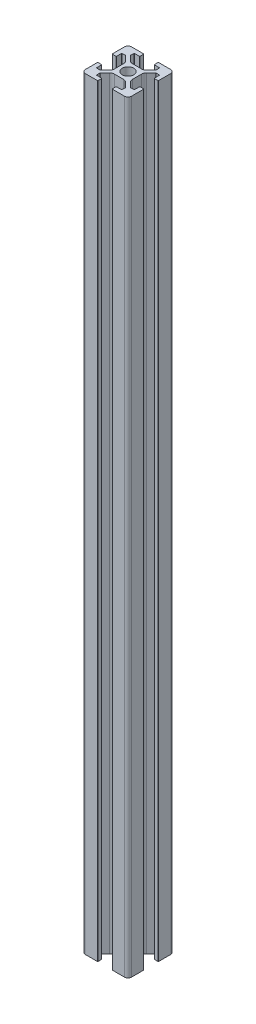
from build123d import *
from build123d.topology import SkipClean

# Parameters (mm, degrees)
BOSS_EXTRUDE1_DEPTH = 330
FILLET1_R           = 1.5
FILLET2_R           = 0.2
FILLET3_R           = 2
SKETCH2_R           = 2.1
CUT_EXTRUDE1_DEPTH  = 332.209903234


with BuildPart() as part:
    # Sketch1 → Boss-Extrude1 (new body)
    with BuildSketch(Plane(origin=(0, 0, 0), x_dir=(1, 0, 0), z_dir=(0, 1, 0))):
        Polygon((0, 20), (0, 13.1), (1.8, 13.1), (1.8, 15.5), (1.8, 17.139339828), (1.8, 18.2), (2.860660172, 18.2), (4.5, 18.2), (6.9, 18.2), (6.9, 20), align=None)
        Polygon((1.8, 18.2), (1.8, 17.139339828), (3.439339828, 15.5), (4.5, 15.5), (4.5, 16.560660172), (2.860660172, 18.2), align=None)
        Polygon((4.5, 16.560660172), (4.5, 18.2), (2.860660172, 18.2), align=None)
        Polygon((1.8, 17.139339828), (1.8, 15.5), (3.439339828, 15.5), align=None)
        Polygon((4.5, 15.5), (3.439339828, 15.5), (6.1, 12.839339828), (6.1, 13.9), (7.160660172, 13.9), (4.5, 16.560660172), align=None)
        Polygon((18.2, 13.1), (20, 13.1), (20, 20), (13.1, 20), (13.1, 18.2), (15.5, 18.2), (17.139339828, 18.2), (18.2, 18.2), (18.2, 17.139339828), (18.2, 15.5), align=None)
        Polygon((17.139339828, 18.2), (15.5, 18.2), (15.5, 16.560660172), align=None)
        Polygon((16.560660172, 15.5), (18.2, 17.139339828), (18.2, 18.2), (17.139339828, 18.2), (15.5, 16.560660172), (15.5, 15.5), align=None)
        Polygon((16.560660172, 15.5), (18.2, 15.5), (18.2, 17.139339828), align=None)
        Polygon((13.9, 12.839339828), (16.560660172, 15.5), (15.5, 15.5), (15.5, 16.560660172), (12.839339828, 13.9), (13.9, 13.9), align=None)
        with BuildLine():
            Line((12.839339828, 13.9), (7.160660172, 13.9))
            Line((7.160660172, 13.9), (8.84398789, 12.216672281))
            ThreePointArc((8.84398789, 12.216672281), (10, 12.5), (11.15601211, 12.216672281))
            Line((11.15601211, 12.216672281), (12.839339828, 13.9))
        make_face()
        with BuildLine():
            Line((6.1, 13.9), (6.1, 12.839339828))
            Line((6.1, 12.839339828), (7.783327719, 11.15601211))
            ThreePointArc((7.783327719, 11.15601211), (8.232233047, 11.767766953), (8.84398789, 12.216672281))
            Line((8.84398789, 12.216672281), (7.160660172, 13.9))
            Line((7.160660172, 13.9), (6.1, 13.9))
        make_face()
        with BuildLine():
            Line((12.216672281, 11.15601211), (13.9, 12.839339828))
            Line((13.9, 12.839339828), (13.9, 13.9))
            Line((13.9, 13.9), (12.839339828, 13.9))
            Line((12.839339828, 13.9), (11.15601211, 12.216672281))
            ThreePointArc((11.15601211, 12.216672281), (11.767766953, 11.767766953), (12.216672281, 11.15601211))
        make_face()
        with BuildLine():
            Line((12.216672281, 8.84398789), (13.9, 7.160660172))
            Line((13.9, 7.160660172), (13.9, 12.839339828))
            Line((13.9, 12.839339828), (12.216672281, 11.15601211))
            ThreePointArc((12.216672281, 11.15601211), (12.428135159, 10.595113139), (12.5, 10))
            ThreePointArc((12.5, 10), (12.428135159, 9.404886861), (12.216672281, 8.84398789))
        make_face()
        with BuildLine():
            Line((6.1, 12.839339828), (6.1, 7.160660172))
            Line((6.1, 7.160660172), (7.783327719, 8.84398789))
            ThreePointArc((7.783327719, 8.84398789), (7.5, 10), (7.783327719, 11.15601211))
            Line((7.783327719, 11.15601211), (6.1, 12.839339828))
        make_face()
        with BuildLine():
            Line((6.1, 6.1), (7.160660172, 6.1))
            Line((7.160660172, 6.1), (8.84398789, 7.783327719))
            ThreePointArc((8.84398789, 7.783327719), (8.232233047, 8.232233047), (7.783327719, 8.84398789))
            Line((7.783327719, 8.84398789), (6.1, 7.160660172))
            Line((6.1, 7.160660172), (6.1, 6.1))
        make_face()
        with BuildLine():
            Line((8.84398789, 7.783327719), (7.160660172, 6.1))
            Line((7.160660172, 6.1), (12.839339828, 6.1))
            Line((12.839339828, 6.1), (11.15601211, 7.783327719))
            ThreePointArc((11.15601211, 7.783327719), (10, 7.5), (8.84398789, 7.783327719))
        make_face()
        with BuildLine():
            Line((11.15601211, 7.783327719), (12.839339828, 6.1))
            Line((12.839339828, 6.1), (13.9, 6.1))
            Line((13.9, 6.1), (13.9, 7.160660172))
            Line((13.9, 7.160660172), (12.216672281, 8.84398789))
            ThreePointArc((12.216672281, 8.84398789), (11.767766953, 8.232233047), (11.15601211, 7.783327719))
        make_face()
        Polygon((4.5, 4.5), (4.5, 3.439339828), (7.160660172, 6.1), (6.1, 6.1), (6.1, 7.160660172), (3.439339828, 4.5), align=None)
        Polygon((12.839339828, 6.1), (15.5, 3.439339828), (15.5, 4.5), (16.560660172, 4.5), (13.9, 7.160660172), (13.9, 6.1), align=None)
        Polygon((3.439339828, 4.5), (1.8, 4.5), (1.8, 2.860660172), align=None)
        Polygon((1.8, 1.8), (2.860660172, 1.8), (4.5, 3.439339828), (4.5, 4.5), (3.439339828, 4.5), (1.8, 2.860660172), align=None)
        Polygon((2.860660172, 1.8), (4.5, 1.8), (4.5, 3.439339828), align=None)
        Polygon((0, 6.9), (0, 0), (6.9, 0), (6.9, 1.8), (4.5, 1.8), (2.860660172, 1.8), (1.8, 1.8), (1.8, 2.860660172), (1.8, 4.5), (1.8, 6.9), align=None)
        Polygon((18.2, 2.860660172), (18.2, 4.5), (16.560660172, 4.5), align=None)
        Polygon((15.5, 3.439339828), (17.139339828, 1.8), (18.2, 1.8), (18.2, 2.860660172), (16.560660172, 4.5), (15.5, 4.5), align=None)
        Polygon((15.5, 3.439339828), (15.5, 1.8), (17.139339828, 1.8), align=None)
        Polygon((13.1, 1.8), (13.1, 0), (20, 0), (20, 6.9), (18.2, 6.9), (18.2, 4.5), (18.2, 2.860660172), (18.2, 1.8), (17.139339828, 1.8), (15.5, 1.8), align=None)
    extrude(amount=BOSS_EXTRUDE1_DEPTH)

    # Fillet1
    fillet1_edges = [part.edges().sort_by_distance(p)[0] for p in [
        (0, 165, 0),
        (0, 165, -20),
        (20, 165, -20),
        (20, 165, 0),
    ]]
    fillet(fillet1_edges, radius=FILLET1_R)

    # Fillet2
    fillet2_edges = [part.edges().sort_by_distance(p)[0] for p in [
        (6.9, 165, -1.8),
        (6.9, 165, 0),
        (0, 165, -6.9),
        (1.8, 165, -6.9),
        (1.8, 165, -4.5),
        (3.439339828, 165, -4.5),
        (3.439339828, 165, -15.5),
        (1.8, 165, -15.5),
        (1.8, 165, -13.1),
        (0, 165, -13.1),
        (6.9, 165, -20),
        (6.9, 165, -18.2),
        (4.5, 165, -18.2),
        (4.5, 165, -16.560660172),
        (15.5, 165, -16.560660172),
        (15.5, 165, -18.2),
        (13.1, 165, -18.2),
        (13.1, 165, -20),
        (20, 165, -13.1),
        (18.2, 165, -13.1),
        (18.2, 165, -15.5),
        (16.560660172, 165, -15.5),
        (16.560660172, 165, -4.5),
        (18.2, 165, -4.5),
        (18.2, 165, -6.9),
        (20, 165, -6.9),
        (13.1, 165, 0),
        (13.1, 165, -1.8),
        (15.5, 165, -1.8),
        (15.5, 165, -3.439339828),
        (4.5, 165, -3.439339828),
        (4.5, 165, -1.8),
    ]]
    fillet(fillet2_edges, radius=FILLET2_R)

    # Fillet3
    fillet3_edges = [part.edges().sort_by_distance(p)[0] for p in [
        (6.1, 165, -7.160660172),
        (6.1, 165, -12.839339828),
        (7.160660172, 165, -13.9),
        (12.839339828, 165, -13.9),
        (13.9, 165, -12.839339828),
        (13.9, 165, -7.160660172),
        (12.839339828, 165, -6.1),
        (7.160660172, 165, -6.1),
    ]]
    fillet(fillet3_edges, radius=FILLET3_R)

    # Sketch2 → Cut-Extrude1 (cut, through all)
    with SkipClean():  # the faces are left unmerged after this step: merging them gives an invalid solid
        with BuildSketch(Plane(origin=(0, 0, -20), x_dir=(-1, 0, 0), z_dir=(0, 0, -1))):
            with Locations(Location((-10, 304, 0), (0, 0, 16.748783839))):
                Circle(SKETCH2_R)
            with Locations(Location((-10, 268, 0), (0, 0, 16.748783839))):
                Circle(SKETCH2_R)
            with Locations(Location((-10, 46, 0), (0, 0, 16.748783839))):
                Circle(SKETCH2_R)
            with Locations(Location((-10, 10, 0), (0, 0, 16.748783839))):
                Circle(SKETCH2_R)
        extrude(amount=-CUT_EXTRUDE1_DEPTH, mode=Mode.SUBTRACT)


solid = part.part
